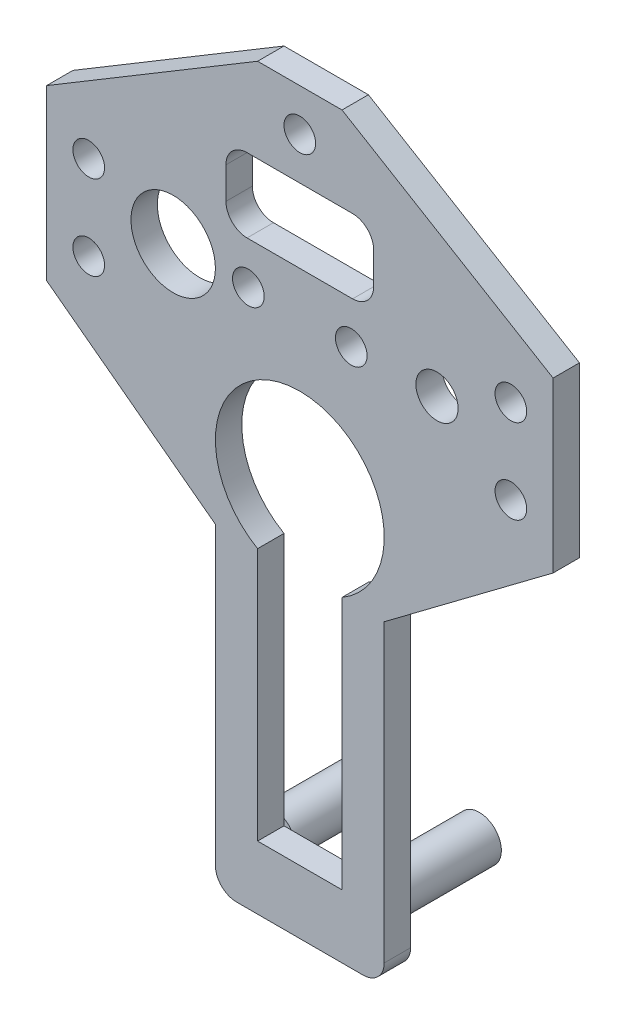
from build123d import *

# Parameters (mm, degrees)
SKETCH1_R           = 4
SKETCH1_R_2         = 1.5
SKETCH1_R_3         = 2
BOSS_EXTRUDE1_DEPTH = 2.5
SKETCH2_R           = 2.1
BOSS_EXTRUDE2_DEPTH = 9.5


with BuildPart() as part:
    # Sketch1 → Boss-Extrude1 (new body)
    with BuildSketch(Plane.XY):
        with BuildLine():
            Line((-24, 5.07179677), (-24, 21.07179677))
            Line((-24, 21.07179677), (-4, 33.07179677))
            Line((-4, 33.07179677), (4, 33.07179677))
            Line((4, 33.07179677), (24, 21.07179677))
            Line((24, 21.07179677), (24, 5.07179677))
            Line((24, 5.07179677), (8, -6.92820323))
            Line((8, -6.92820323), (8, -34.92820323))
            ThreePointArc((8, -34.92820323), (7.414213562, -36.342416793), (6, -36.92820323))
            Line((6, -36.92820323), (-6, -36.92820323))
            ThreePointArc((-6, -36.92820323), (-7.414213562, -36.342416793), (-8, -34.92820323))
            Line((-8, -34.92820323), (-8, -6.92820323))
            Line((-8, -6.92820323), (-24, 5.07179677))
        make_face()
        with Locations((-12, 14.07179677)):
            Circle(SKETCH1_R, mode=Mode.SUBTRACT)
        with Locations((-4.875, 14.07179677)):
            Circle(SKETCH1_R_2, mode=Mode.SUBTRACT)
        with Locations((4.875, 14.07179677)):
            Circle(SKETCH1_R_2, mode=Mode.SUBTRACT)
        with Locations((0, 29.07179677)):
            Circle(SKETCH1_R_2, mode=Mode.SUBTRACT)
        with Locations((20, 17.07179677)):
            Circle(SKETCH1_R_2, mode=Mode.SUBTRACT)
        with Locations((20, 9.07179677)):
            Circle(SKETCH1_R_2, mode=Mode.SUBTRACT)
        with Locations((-20, 17.07179677)):
            Circle(SKETCH1_R_2, mode=Mode.SUBTRACT)
        with Locations((-20, 9.07179677)):
            Circle(SKETCH1_R_2, mode=Mode.SUBTRACT)
        with Locations((13, 14.07179677)):
            Circle(SKETCH1_R_3, mode=Mode.SUBTRACT)
        with BuildLine():
            Line((4, -30.92820323), (-4, -30.92820323))
            Line((-4, -30.92820323), (-4, -6.92820323))
            ThreePointArc((-4, -6.92820323), (0, 8), (4, -6.92820323))
            Line((4, -6.92820323), (4, -30.92820323))
        make_face(mode=Mode.SUBTRACT)
        with BuildLine():
            Line((-5, 25.07179677), (5, 25.07179677))
            ThreePointArc((5, 25.07179677), (6.414213562, 24.486010332), (7, 23.07179677))
            Line((7, 23.07179677), (7, 20.07179677))
            ThreePointArc((7, 20.07179677), (6.414213562, 18.657583207), (5, 18.07179677))
            Line((5, 18.07179677), (-5, 18.07179677))
            ThreePointArc((-5, 18.07179677), (-6.414213562, 18.657583207), (-7, 20.07179677))
            Line((-7, 20.07179677), (-7, 23.07179677))
            ThreePointArc((-7, 23.07179677), (-6.414213562, 24.486010332), (-5, 25.07179677))
        make_face(mode=Mode.SUBTRACT)
    extrude(amount=BOSS_EXTRUDE1_DEPTH)

    # Sketch2 → Boss-Extrude2 (add)
    with BuildSketch(Plane(origin=(0, 0, 0), x_dir=(-1, 0, 0), z_dir=(0, 0, -1))):
        with Locations(Location((-5, -32.16164975, 0), (0, 0, 61.563109851))):
            Circle(SKETCH2_R)
        with Locations(Location((5, -32.16164975, 0), (0, 0, 144.030430851))):
            Circle(SKETCH2_R)
    extrude(amount=BOSS_EXTRUDE2_DEPTH)


solid = part.part
